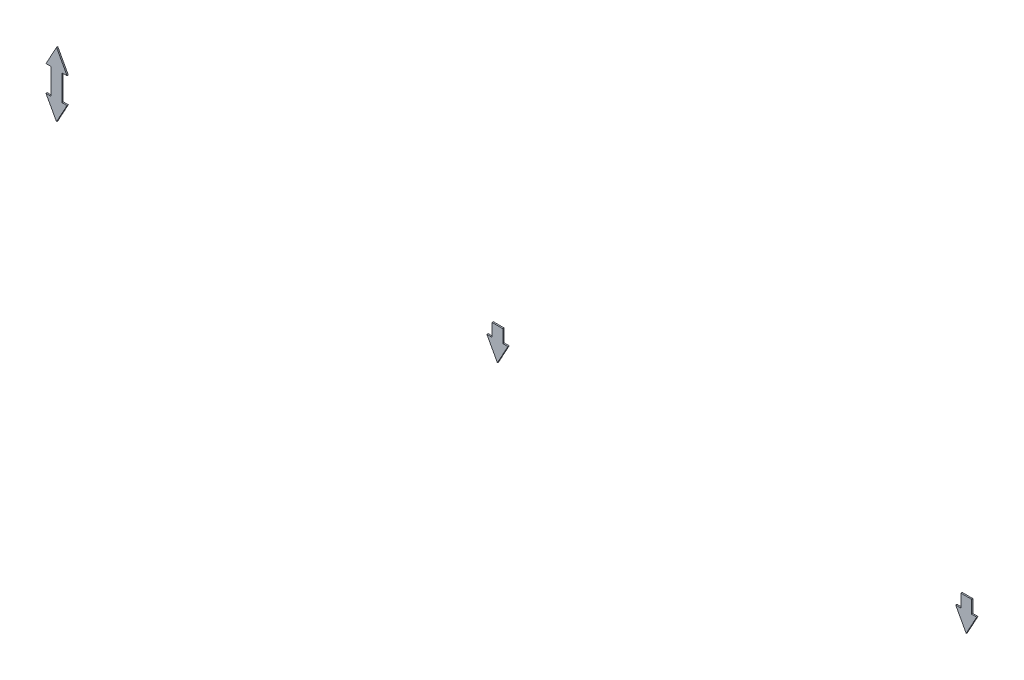
from build123d import *

# Parameters (mm, degrees)
BOSS_EXTRUDE1_DEPTH   = 30
BOSS_EXTRUDE1_2_DEPTH = 30
BOSS_EXTRUDE1_3_DEPTH = 30


with BuildPart() as part:
    # Sketch1 → Boss-Extrude1 (new body)
    with BuildSketch(Plane.XY):
        Polygon((7464.051241567, 925.53062986), (7464.051241567, 1525.53062986), (7583.473483246, 1525.53062986), (7339.051241567, 1974.530546162), (7094.628999888, 1525.53062986), (7214.051241567, 1525.53062986), (7214.051241567, 925.53062986), (7094.628999888, 925.53062986), (7339.051241567, 476.530713559), (7583.473483246, 925.53062986), align=None)
    extrude(amount=BOSS_EXTRUDE1_DEPTH)


with BuildPart() as body_2:
    # Sketch1 → Boss-Extrude1 2 (new body)
    with BuildSketch(Plane.XY):
        Polygon((17715.548618468, 1198.65057849), (17715.548618468, 1498.65057849), (17465.548618468, 1498.65057849), (17465.548618468, 1198.65057849), (17346.126376789, 1198.65057849), (17590.548618468, 749.650662188), (17834.970860147, 1198.65057849), align=None)
    extrude(amount=BOSS_EXTRUDE1_2_DEPTH)


with BuildPart() as body_3:
    # Sketch1 → Boss-Extrude1 3 (new body)
    with BuildSketch(Plane.XY):
        Polygon((28734.970860147, 1198.65057849), (28490.548618468, 749.650662188), (28246.126376789, 1198.65057849), (28365.548618468, 1198.65057849), (28365.548618468, 1498.65057849), (28615.548618468, 1498.65057849), (28615.548618468, 1198.65057849), align=None)
    extrude(amount=BOSS_EXTRUDE1_3_DEPTH)


solid = Compound([part.part, body_2.part, body_3.part])
